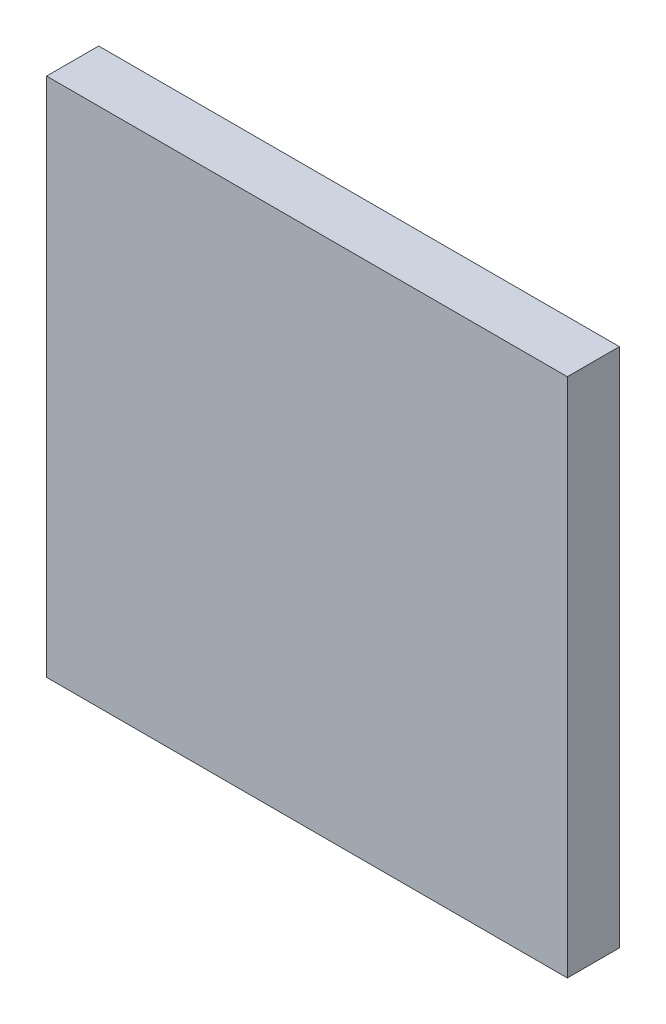
from build123d import *

# Parameters (mm, degrees)
CROQUIS1_W              = 10
CROQUIS1_H              = 10
SALIENTE_EXTRUIR1_DEPTH = 1


with BuildPart() as part:
    # Croquis1 → Saliente-Extruir1 (new body)
    with BuildSketch(Plane.XY):
        Rectangle(CROQUIS1_W, CROQUIS1_H)
    extrude(amount=SALIENTE_EXTRUIR1_DEPTH)


solid = part.part
